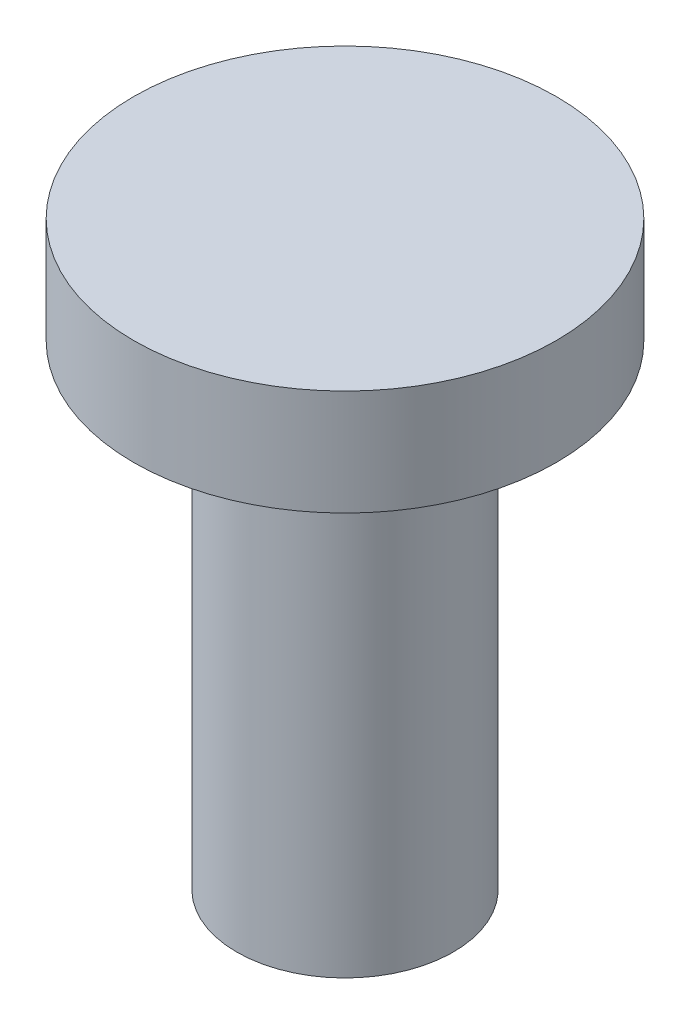
from build123d import *

# Parameters (mm, degrees)
SKETCH1_R           = 1.025
BOSS_EXTRUDE1_DEPTH = 4.5
SKETCH2_R           = 2
BOSS_EXTRUDE2_DEPTH = 1


with BuildPart() as part:
    # Sketch1 → Boss-Extrude1 (new body)
    with BuildSketch(Plane(origin=(0, 0, 0), x_dir=(1, 0, 0), z_dir=(0, 1, 0))):
        with Locations(Location((0, 0, 0), (0, 0, 270))):
            Circle(SKETCH1_R)
    extrude(amount=BOSS_EXTRUDE1_DEPTH)

    # Sketch2 → Boss-Extrude2 (add)
    with BuildSketch(Plane(origin=(0, 4.5, 0), x_dir=(1, 0, 0), z_dir=(0, 1, 0))):
        with Locations(Location((0, 0, 0), (0, 0, 270))):
            Circle(SKETCH2_R)
    extrude(amount=BOSS_EXTRUDE2_DEPTH)


solid = part.part
